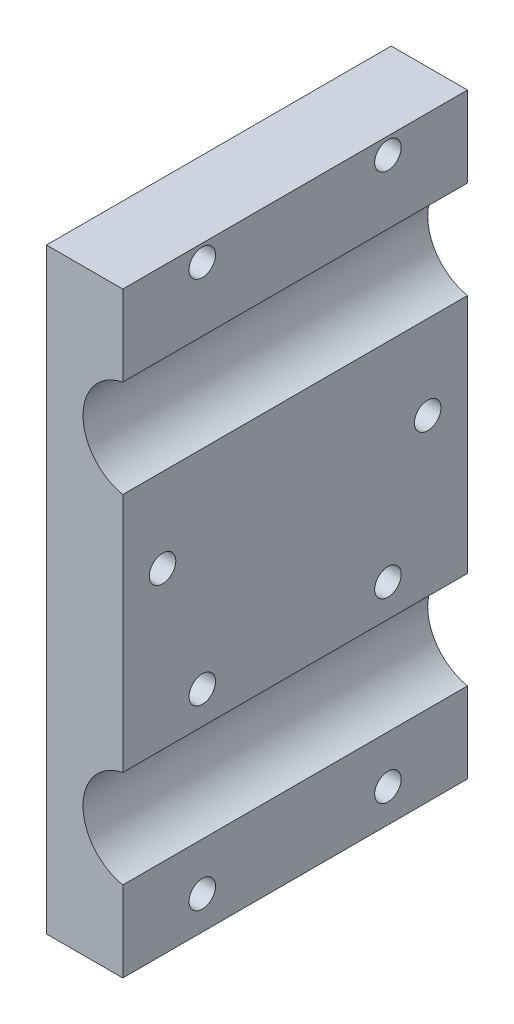
from build123d import *

# Parameters (mm, degrees)
BOSS_EXTRUDE1_DEPTH     = 52
SKETCH2_R               = 2
CUT_EXTRUDE1_DEPTH      = 105.576527003
ESQUISSE1_R             = 2
ENL_V_MAT_EXTRU_1_DEPTH = 105.576527003
ESQUISSE2_R             = 2
ENL_V_MAT_EXTRU_2_DEPTH = 105.576527003


with BuildPart() as part:
    # Sketch1 → Boss-Extrude1 (new body)
    with BuildSketch(Plane.XY):
        with BuildLine():
            Line((0, -12.151530772), (0, 0))
            Line((0, 0), (-11.5, 0))
            Line((-11.5, 0), (-11.5, -45))
            Line((-11.5, -45), (0, -45))
            Line((0, -45), (0, -26.848469228))
            ThreePointArc((0, -26.848469228), (-6, -19.5), (0, -12.151530772))
        make_face()
        with BuildLine():
            Line((0, -45), (-11.5, -45))
            Line((-11.5, -45), (-11.5, -90))
            Line((-11.5, -90), (0, -90))
            Line((0, -90), (0, -77.848469228))
            ThreePointArc((0, -77.848469228), (-6, -70.5), (0, -63.151530772))
            Line((0, -63.151530772), (0, -45))
        make_face()
    extrude(amount=BOSS_EXTRUDE1_DEPTH)

    # Sketch2 → Cut-Extrude1 (cut, through all)
    with BuildSketch(Plane(origin=(0, 0, 0), x_dir=(0, 0, -1), z_dir=(1, 0, 0))):
        with Locations(Location((-40, -2.5, 0), (0, 0, 90))):
            Circle(SKETCH2_R)
        with Locations(Location((-40, -85, 0), (0, 0, 90))):
            Circle(SKETCH2_R)
        with Locations(Location((-12, -85, 0), (0, 0, 90))):
            Circle(SKETCH2_R)
        with Locations(Location((-12, -2.5, 0), (0, 0, 90))):
            Circle(SKETCH2_R)
    extrude(amount=-CUT_EXTRUDE1_DEPTH, mode=Mode.SUBTRACT)

    # Esquisse1 → Enlèv. mat.-Extru.1 (cut, through all)
    with BuildSketch(Plane(origin=(0, 0, 0), x_dir=(0, 0, -1), z_dir=(1, 0, 0))):
        with Locations(Location((-12, -58.25, 0), (0, 0, 90))):
            Circle(ESQUISSE1_R)
        with Locations(Location((-40, -58.25, 0), (0, 0, 90))):
            Circle(ESQUISSE1_R)
    extrude(amount=-ENL_V_MAT_EXTRU_1_DEPTH, mode=Mode.SUBTRACT)

    # Esquisse2 → Enlèv. mat.-Extru.2 (cut, through all)
    with BuildSketch(Plane(origin=(0, 0, 0), x_dir=(0, 0, -1), z_dir=(1, 0, 0))):
        with Locations(Location((-6, -39.5, 0), (0, 0, 90))):
            Circle(ESQUISSE2_R)
        with Locations(Location((-46, -39.5, 0), (0, 0, 90))):
            Circle(ESQUISSE2_R)
    extrude(amount=-ENL_V_MAT_EXTRU_2_DEPTH, mode=Mode.SUBTRACT)


solid = part.part
